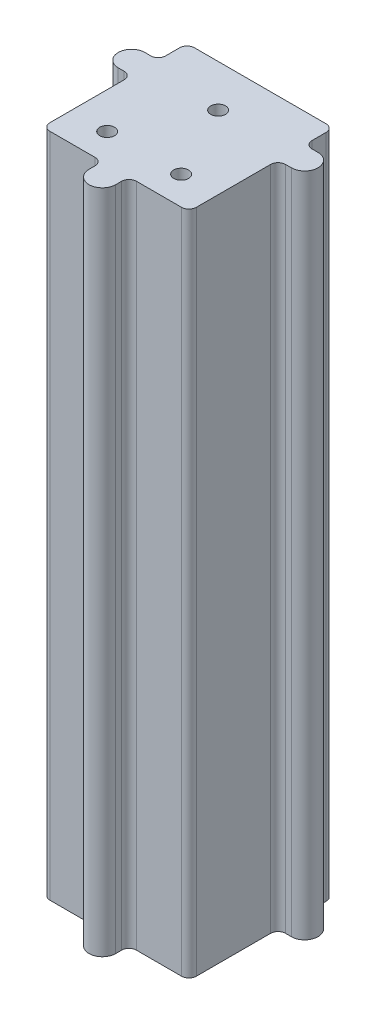
from build123d import *

# Parameters (mm, degrees)
BOSS_EXTRUDE1_DEPTH = 180
SKETCH12_R          = 1.55
CUT_EXTRUDE1_DEPTH  = 20
SKETCH13_R          = 2
CUT_EXTRUDE2_DEPTH  = 20


with BuildPart() as part:
    # Sketch1 → Boss-Extrude1 (new body)
    with BuildSketch(Plane.XZ):
        with BuildLine():
            Line((-17.8, -24.145), (-3.6, -24.145))
            Line((-3.6, -24.145), (3.6, -24.145))
            Line((3.6, -24.145), (17.8, -24.145))
            ThreePointArc((17.8, -24.145), (19.214213562, -23.559213562), (19.8, -22.145))
            Line((19.8, -22.145), (19.8, -18.345))
            ThreePointArc((19.8, -18.345), (20.385786438, -16.930786438), (21.8, -16.345))
            Line((21.8, -16.345), (23.4, -16.345))
            ThreePointArc((23.4, -16.345), (27, -12.745), (23.4, -9.145))
            Line((23.4, -9.145), (21.8, -9.145))
            ThreePointArc((21.8, -9.145), (20.385786438, -8.559213562), (19.8, -7.145))
            Line((19.8, -7.145), (19.8, 12.945))
            ThreePointArc((19.8, 12.945), (19.214213562, 14.359213562), (17.8, 14.945))
            Line((17.8, 14.945), (5.6, 14.945))
            ThreePointArc((5.6, 14.945), (4.185786438, 15.530786438), (3.6, 16.945))
            Line((3.6, 16.945), (3.6, 18.545))
            ThreePointArc((3.6, 18.545), (0, 22.145), (-3.6, 18.545))
            Line((-3.6, 18.545), (-3.6, 16.945))
            ThreePointArc((-3.6, 16.945), (-4.185786438, 15.530786438), (-5.6, 14.945))
            Line((-5.6, 14.945), (-17.8, 14.945))
            ThreePointArc((-17.8, 14.945), (-19.214213562, 14.359213562), (-19.8, 12.945))
            Line((-19.8, 12.945), (-19.8, -7.145))
            ThreePointArc((-19.8, -7.145), (-20.385786438, -8.559213562), (-21.8, -9.145))
            Line((-21.8, -9.145), (-23.4, -9.145))
            ThreePointArc((-23.4, -9.145), (-27, -12.745), (-23.4, -16.345))
            Line((-23.4, -16.345), (-21.8, -16.345))
            ThreePointArc((-21.8, -16.345), (-20.385786438, -16.930786438), (-19.8, -18.345))
            Line((-19.8, -18.345), (-19.8, -22.145))
            ThreePointArc((-19.8, -22.145), (-19.214213562, -23.559213562), (-17.8, -24.145))
        make_face()
    extrude(amount=-BOSS_EXTRUDE1_DEPTH)

    # Sketch12 → Cut-Extrude1 (cut)
    with BuildSketch(Plane.XZ):
        with Locations(Location((0, 18.545, 0), (0, 0, 270))):
            Circle(SKETCH12_R)
        with Locations(Location((-23.4, -12.745, 0), (0, 0, 270))):
            Circle(SKETCH12_R)
        with Locations(Location((23.4, -12.745, 0), (0, 0, 270))):
            Circle(SKETCH12_R)
    extrude(amount=-CUT_EXTRUDE1_DEPTH, mode=Mode.SUBTRACT)

    # Sketch13 → Cut-Extrude2 (cut)
    with BuildSketch(Plane(origin=(0, 180, 0), x_dir=(1, 0, 0), z_dir=(0, 1, 0))):
        with Locations(Location((0, 12.745, 0), (0, 0, 270))):
            Circle(SKETCH13_R)
        with Locations(Location((10, -7.255, 0), (0, 0, 270))):
            Circle(SKETCH13_R)
        with Locations(Location((-10, -7.255, 0), (0, 0, 90))):
            Circle(SKETCH13_R)
    extrude(amount=-CUT_EXTRUDE2_DEPTH, mode=Mode.SUBTRACT)


solid = part.part
